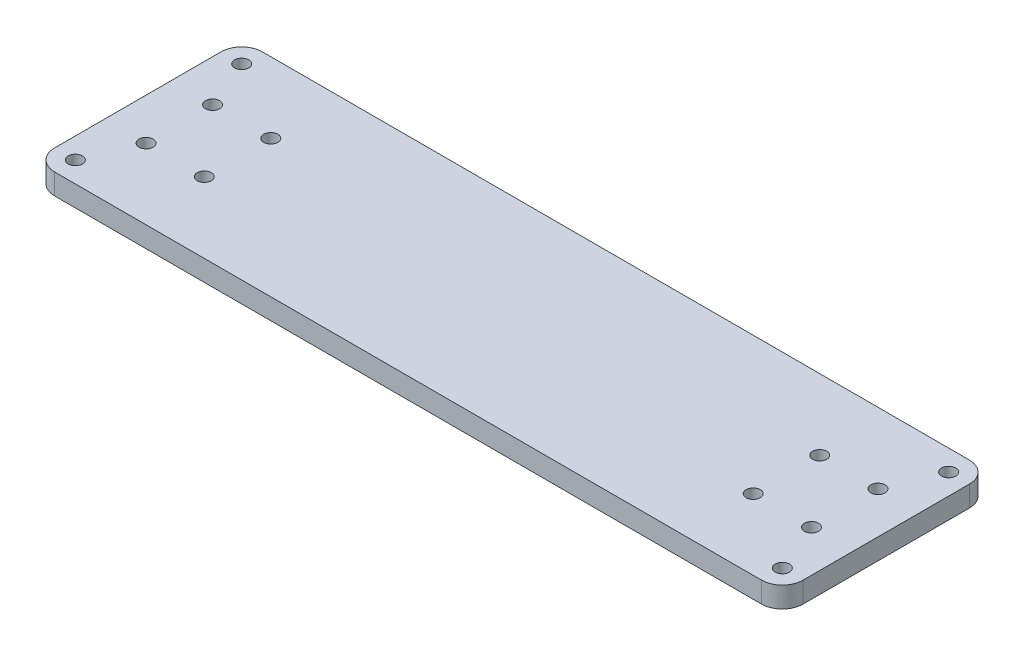
from build123d import *

# Parameters (mm, degrees)
SKETCH_1_R      = 1.7
EXTRUDE_1_DEPTH = 5


with BuildPart() as part:
    # 草图1 → 凸台-拉伸1 (new body)
    with BuildSketch(Plane(origin=(0, 0, 0), x_dir=(1, 0, 0), z_dir=(0, 1, 0))):
        with BuildLine():
            Line((-85, 25), (85, 25))
            ThreePointArc((85, 25), (88.535533906, 23.535533906), (90, 20))
            Line((90, 20), (90, -20))
            ThreePointArc((90, -20), (88.535533906, -23.535533906), (85, -25))
            Line((85, -25), (-85, -25))
            ThreePointArc((-85, -25), (-88.535533906, -23.535533906), (-90, -20))
            Line((-90, -20), (-90, 20))
            ThreePointArc((-90, 20), (-88.535533906, 23.535533906), (-85, 25))
        make_face()
        with Locations(Location((-85, 20, 0), (0, 0, 270))):
            Circle(SKETCH_1_R, mode=Mode.SUBTRACT)
        with Locations(Location((-85, -20, 0), (0, 0, 270))):
            Circle(SKETCH_1_R, mode=Mode.SUBTRACT)
        with Locations(Location((85, 20, 0), (0, 0, 270))):
            Circle(SKETCH_1_R, mode=Mode.SUBTRACT)
        with Locations(Location((85, -20, 0), (0, 0, 270))):
            Circle(SKETCH_1_R, mode=Mode.SUBTRACT)
        with Locations(Location((-80, 8, 0), (0, 0, 270))):
            Circle(SKETCH_1_R, mode=Mode.SUBTRACT)
        with Locations(Location((-80, -8, 0), (0, 0, 270))):
            Circle(SKETCH_1_R, mode=Mode.SUBTRACT)
        with Locations(Location((-66, -8, 0), (0, 0, 90))):
            Circle(SKETCH_1_R, mode=Mode.SUBTRACT)
        with Locations(Location((-66, 8, 0), (0, 0, 90))):
            Circle(SKETCH_1_R, mode=Mode.SUBTRACT)
        with Locations(Location((66, -8, 0), (0, 0, 270))):
            Circle(SKETCH_1_R, mode=Mode.SUBTRACT)
        with Locations(Location((66, 8, 0), (0, 0, 270))):
            Circle(SKETCH_1_R, mode=Mode.SUBTRACT)
        with Locations(Location((80, -8, 0), (0, 0, 90))):
            Circle(SKETCH_1_R, mode=Mode.SUBTRACT)
        with Locations(Location((80, 8, 0), (0, 0, 90))):
            Circle(SKETCH_1_R, mode=Mode.SUBTRACT)
    extrude(amount=EXTRUDE_1_DEPTH)


solid = part.part
